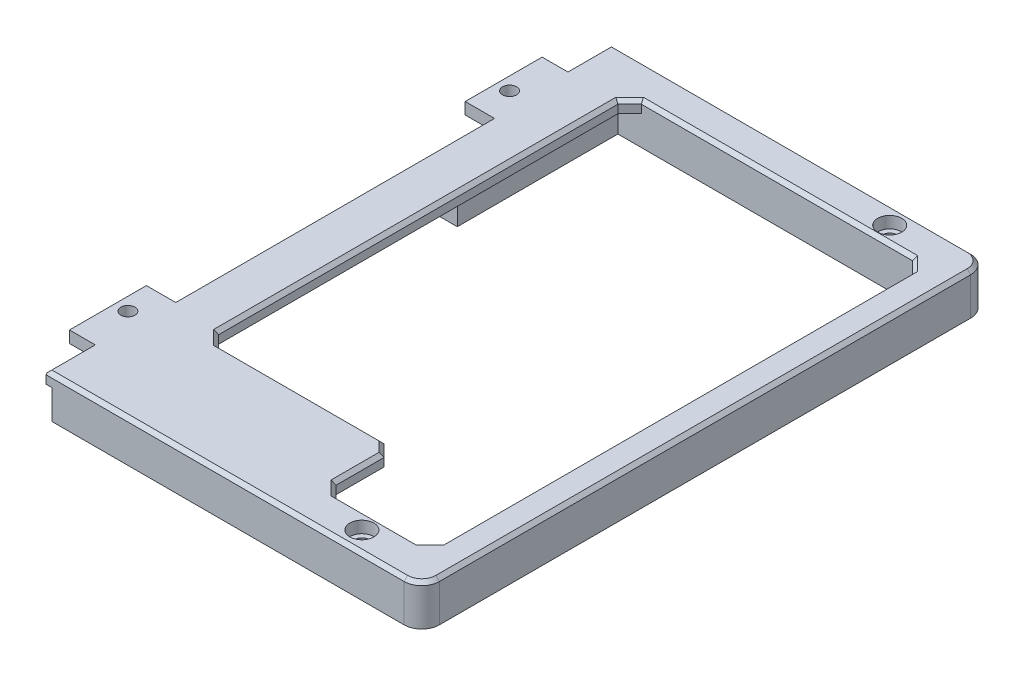
from build123d import *

# Parameters (mm, degrees)
SKETCH_2_W           = 96.5
SKETCH_2_H           = 7
EXTRUDE_1_DEPTH      = 11
SKETCH_6_W           = 5
SKETCH_6_H           = 2.5
CUT_EXTRUDE_3_DEPTH  = 98.376845297
SKETCH_7_W           = 54.3
SKETCH_7_H           = 10
CUT_EXTRUDE_4_DEPTH  = 5
SKETCH_8_R           = 1.2
CUT_EXTRUDE_6_DEPTH  = 98.376845297
SKETCH_10_W          = 96.5
SKETCH_10_H          = 7
EXTRUDE_2_DEPTH      = 57
SKETCH_11_W          = 8
SKETCH_11_H          = 2
CUT_EXTRUDE_7_DEPTH  = 4
CHAMFER_1_SIZE       = 0.4
FILLET_1_R           = 3
SKETCH_12_W          = 54.2
SKETCH_12_H          = 84.200000954
CUT_EXTRUDE_8_DEPTH  = 5
CUT_EXTRUDE_9_DEPTH  = 119.15773356
CHAMFER_2_SIZE       = 2
CHAMFER_3_SIZE       = 0.6
SKETCH_17_W          = 13
SKETCH_17_H          = 8
CUT_EXTRUDE_10_DEPTH = 0.6
CUT_EXTRUDE_11_DEPTH = 4
CHAMFER_4_SIZE       = 1.5
SKETCH_19_R          = 2.05
CUT_EXTRUDE_12_DEPTH = 2
SKETCH_20_R          = 1.2
CUT_EXTRUDE_13_DEPTH = 119.15773356


with BuildPart() as part:
    # 草图2 → 凸台-拉伸1 (new body)
    with BuildSketch(Plane(origin=(0, 0, 0), x_dir=(0, 0, -1), z_dir=(1, 0, 0))):
        with Locations((48.25, 3.5)):
            Rectangle(SKETCH_2_W, SKETCH_2_H)
    extrude(amount=EXTRUDE_1_DEPTH)

    # 草图6 → 切除-拉伸3 (cut, through all)
    with BuildSketch(Plane(origin=(0, 0, -96.5), x_dir=(-1, 0, 0), z_dir=(0, 0, -1))):
        with Locations((-2.5, 3.75)):
            Rectangle(SKETCH_6_W, SKETCH_6_H)
        with Locations((-2.5, 1.25)):
            Rectangle(SKETCH_6_W, SKETCH_6_H)
    extrude(amount=-CUT_EXTRUDE_3_DEPTH, mode=Mode.SUBTRACT)

    # 草图7 → 切除-拉伸4 (cut)
    with BuildSketch(Plane.ZY):
        with Locations((-48.25, 9)):
            Rectangle(SKETCH_7_W, SKETCH_7_H)
    extrude(amount=-CUT_EXTRUDE_4_DEPTH, mode=Mode.SUBTRACT)

    # 草图8 → 切除-拉伸6 (cut, through all)
    with BuildSketch(Plane(origin=(0, 7, 0), x_dir=(1, 0, 0), z_dir=(0, 1, 0))):
        with Locations(Location((2.2, 15.75, 0), (0, 0, 270))):
            Circle(SKETCH_8_R)
        with Locations(Location((2.2, 80.75, 0), (0, 0, 270))):
            Circle(SKETCH_8_R)
    extrude(amount=-CUT_EXTRUDE_6_DEPTH, mode=Mode.SUBTRACT)

    # 草图10 → 凸台-拉伸2 (add)
    with BuildSketch(Plane(origin=(11, 0, 0), x_dir=(0, 0, -1), z_dir=(1, 0, 0))):
        with Locations((48.25, 3.5)):
            Rectangle(SKETCH_10_W, SKETCH_10_H)
    extrude(amount=EXTRUDE_2_DEPTH)

    # 草图11 → 切除-拉伸7 (cut)
    with BuildSketch(Plane.ZY):
        with Locations((-92.5, 6)):
            Rectangle(SKETCH_11_W, SKETCH_11_H)
        with Locations((-4, 6)):
            Rectangle(SKETCH_11_W, SKETCH_11_H)
    extrude(amount=-CUT_EXTRUDE_7_DEPTH, mode=Mode.SUBTRACT)

    # 倒角1
    chamfer_1_edges = [part.edges().sort_by_distance(p)[0] for p in [
        (4, 7, -92.5),
        (4, 7, -4),
    ]]
    chamfer(chamfer_1_edges, length=CHAMFER_1_SIZE)

    # 圆角1
    fillet_1_edges = [part.edges().sort_by_distance(p)[0] for p in [
        (68, 3.5, 0),
        (68, 3.5, -96.5),
    ]]
    fillet(fillet_1_edges, radius=FILLET_1_R)

    # 草图12 → 切除-拉伸8 (cut)
    with BuildSketch(Plane.XZ):
        with Locations((37.9, -48.499999523)):
            Rectangle(SKETCH_12_W, SKETCH_12_H)
    extrude(amount=-CUT_EXTRUDE_8_DEPTH, mode=Mode.SUBTRACT)

    # 草图16 → 切除-拉伸9 (cut, through all)
    with BuildSketch(Plane.XZ.offset(-5)):
        Polygon((45, -6.399999046), (63, -6.399999046), (63, -90.6), (12.8, -90.6), (12.8, -18.599999046), (45, -18.599999046), align=None)
    extrude(amount=-CUT_EXTRUDE_9_DEPTH, mode=Mode.SUBTRACT)

    # 倒角2
    chamfer_2_edges = [part.edges().sort_by_distance(p)[0] for p in [
        (45, 6, -18.599999046),
        (45, 6, -6.399999046),
        (63, 6, -6.399999046),
        (63, 6, -90.6),
        (12.8, 6, -90.6),
        (12.8, 6, -18.599999046),
    ]]
    chamfer(chamfer_2_edges, length=CHAMFER_2_SIZE)

    # 倒角3
    chamfer_3_edges = [part.edges().sort_by_distance(p)[0] for p in [
        (34.7, 7, -96.5),
        (67.121320344, 7, -95.621320344),
        (68, 7, -48.25),
        (67.121320344, 7, -0.878679656),
        (34.7, 7, 0),
        (62, 7, -89.6),
        (63, 7, -48.499999523),
        (62, 7, -7.399999046),
        (54, 7, -6.399999046),
        (46, 7, -7.399999046),
        (45, 7, -12.499999046),
        (44, 7, -17.599999046),
        (37.9, 7, -90.6),
        (13.8, 7, -89.6),
        (12.8, 7, -54.599999523),
        (13.8, 7, -19.599999046),
        (28.9, 7, -18.599999046),
    ]]
    chamfer(chamfer_3_edges, length=CHAMFER_3_SIZE)

    # 草图17 → 切除-拉伸10 (cut)
    with BuildSketch(Plane.XZ.offset(-5)):
        with Locations((26.1, -10.399999046)):
            Rectangle(SKETCH_17_W, SKETCH_17_H)
    extrude(amount=-CUT_EXTRUDE_10_DEPTH, mode=Mode.SUBTRACT)

    # 草图18 → 切除-拉伸11 (cut)
    with BuildSketch(Plane.XZ):
        Polygon((34.708261144, -6.399999046), (10.8, -6.399999046), (10.8, -63.25), (5, -63.25), (5, -33.25), (7.8, -33.25), (7.8, -1.2), (34.708261144, -1.2), align=None)
    extrude(amount=-CUT_EXTRUDE_11_DEPTH, mode=Mode.SUBTRACT)

    # 倒角4
    chamfer_4_edges = [part.edges().sort_by_distance(p)[0] for p in [
        (7.8, 2, -33.25),
        (7.8, 2, -1.2),
        (34.708261144, 2, -1.2),
    ]]
    chamfer(chamfer_4_edges, length=CHAMFER_4_SIZE)

    # 草图19 → 切除-拉伸12 (cut)
    with BuildSketch(Plane(origin=(0, 7, 0), x_dir=(1, 0, 0), z_dir=(0, 1, 0))):
        with Locations(Location((54.4, 3.4, 0), (0, 0, 270))):
            Circle(SKETCH_19_R)
        with Locations(Location((54.4, 93.3, 0), (0, 0, 270))):
            Circle(SKETCH_19_R)
    extrude(amount=-CUT_EXTRUDE_12_DEPTH, mode=Mode.SUBTRACT)

    # 草图20 → 切除-拉伸13 (cut, through all)
    with BuildSketch(Plane(origin=(0, 5, 0), x_dir=(1, 0, 0), z_dir=(0, 1, 0))):
        with Locations(Location((54.4, 3.4, 0), (0, 0, 270))):
            Circle(SKETCH_20_R)
        with Locations(Location((54.4, 93.3, 0), (0, 0, 270))):
            Circle(SKETCH_20_R)
    extrude(amount=-CUT_EXTRUDE_13_DEPTH, mode=Mode.SUBTRACT)


solid = part.part
